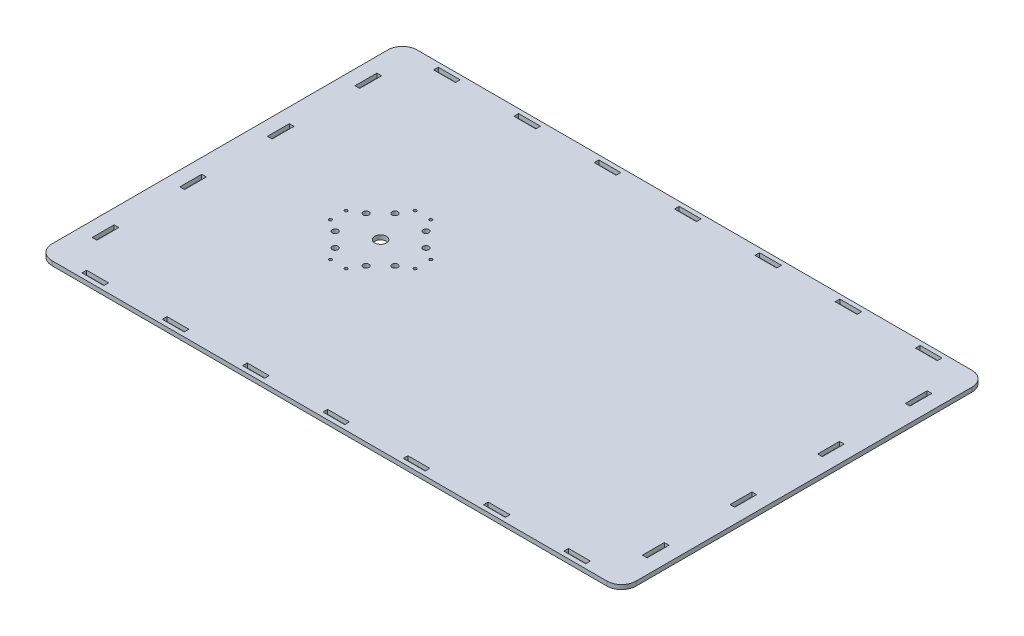
from build123d import *

# Parameters (mm, degrees)
SKETCH1_W           = 400
SKETCH1_H           = 250
SKETCH1_W_2         = 15
SKETCH1_H_2         = 3.2
SKETCH1_W_3         = 3.2
SKETCH1_H_3         = 15
BOSS_EXTRUDE2_DEPTH = 3
FILLET1_R           = 10
SKETCH2_R           = 2
SKETCH2_R_2         = 1
SKETCH2_R_3         = 4
CUT_EXTRUDE1_DEPTH  = 472.708596487


with BuildPart() as part:
    # Sketch1 → Boss-Extrude2 (new body)
    with BuildSketch(Plane(origin=(0, 0, 0), x_dir=(1, 0, 0), z_dir=(0, 1, 0))):
        with Locations((200, 125)):
            Rectangle(SKETCH1_W, SKETCH1_H)
        with Locations((90, 4.6)):
            Rectangle(SKETCH1_W_2, SKETCH1_H_2, mode=Mode.SUBTRACT)
        with Locations((35, 4.6)):
            Rectangle(SKETCH1_W_2, SKETCH1_H_2, mode=Mode.SUBTRACT)
        with Locations((145, 4.6)):
            Rectangle(SKETCH1_W_2, SKETCH1_H_2, mode=Mode.SUBTRACT)
        with Locations((200, 4.6)):
            Rectangle(SKETCH1_W_2, SKETCH1_H_2, mode=Mode.SUBTRACT)
        with Locations((255, 4.6)):
            Rectangle(SKETCH1_W_2, SKETCH1_H_2, mode=Mode.SUBTRACT)
        with Locations((310, 4.6)):
            Rectangle(SKETCH1_W_2, SKETCH1_H_2, mode=Mode.SUBTRACT)
        with Locations((365, 4.6)):
            Rectangle(SKETCH1_W_2, SKETCH1_H_2, mode=Mode.SUBTRACT)
        with Locations((365, 245.4)):
            Rectangle(SKETCH1_W_2, SKETCH1_H_2, mode=Mode.SUBTRACT)
        with Locations((310, 245.4)):
            Rectangle(SKETCH1_W_2, SKETCH1_H_2, mode=Mode.SUBTRACT)
        with Locations((255, 245.4)):
            Rectangle(SKETCH1_W_2, SKETCH1_H_2, mode=Mode.SUBTRACT)
        with Locations((200, 245.4)):
            Rectangle(SKETCH1_W_2, SKETCH1_H_2, mode=Mode.SUBTRACT)
        with Locations((35, 245.4)):
            Rectangle(SKETCH1_W_2, SKETCH1_H_2, mode=Mode.SUBTRACT)
        with Locations((90, 245.4)):
            Rectangle(SKETCH1_W_2, SKETCH1_H_2, mode=Mode.SUBTRACT)
        with Locations((145, 245.4)):
            Rectangle(SKETCH1_W_2, SKETCH1_H_2, mode=Mode.SUBTRACT)
        with Locations((11.6, 95)):
            Rectangle(SKETCH1_W_3, SKETCH1_H_3, mode=Mode.SUBTRACT)
        with Locations((11.6, 35)):
            Rectangle(SKETCH1_W_3, SKETCH1_H_3, mode=Mode.SUBTRACT)
        with Locations((11.6, 155)):
            Rectangle(SKETCH1_W_3, SKETCH1_H_3, mode=Mode.SUBTRACT)
        with Locations((11.6, 215)):
            Rectangle(SKETCH1_W_3, SKETCH1_H_3, mode=Mode.SUBTRACT)
        with Locations((388.4, 35)):
            Rectangle(SKETCH1_W_3, SKETCH1_H_3, mode=Mode.SUBTRACT)
        with Locations((388.4, 95)):
            Rectangle(SKETCH1_W_3, SKETCH1_H_3, mode=Mode.SUBTRACT)
        with Locations((388.4, 155)):
            Rectangle(SKETCH1_W_3, SKETCH1_H_3, mode=Mode.SUBTRACT)
        with Locations((388.4, 215)):
            Rectangle(SKETCH1_W_3, SKETCH1_H_3, mode=Mode.SUBTRACT)
    extrude(amount=BOSS_EXTRUDE2_DEPTH)

    # Fillet1
    fillet1_edges = [part.edges().sort_by_distance(p)[0] for p in [
        (0, 1.5, -250),
        (400, 1.5, -250),
        (400, 1.5, 0),
        (0, 1.5, 0),
    ]]
    fillet(fillet1_edges, radius=FILLET1_R)

    # Sketch2 → Cut-Extrude1 (cut, through all)
    with BuildSketch(Plane(origin=(0, 3, 0), x_dir=(1, 0, 0), z_dir=(0, 1, 0))):
        with Locations(Location((89.493903346, 135.606601718, 0), (0, 0, 270))):
            Circle(SKETCH2_R)
        with Locations(Location((120.606601718, 145.506096654, 0), (0, 0, 270))):
            Circle(SKETCH2_R)
        with Locations(Location((130.506096654, 135.606601718, 0), (0, 0, 270))):
            Circle(SKETCH2_R)
        with Locations(Location((99.393398282, 104.493903346, 0), (0, 0, 270))):
            Circle(SKETCH2_R)
        with Locations(Location((120.606601718, 104.493903346, 0), (0, 0, 270))):
            Circle(SKETCH2_R)
        with Locations(Location((89.493903346, 114.393398282, 0), (0, 0, 270))):
            Circle(SKETCH2_R)
        with Locations(Location((81, 119.62, 0), (0, 0, 270))):
            Circle(SKETCH2_R_2)
        with Locations(Location((110, 125, 0), (0, 0, 270))):
            Circle(SKETCH2_R_3)
        with Locations(Location((81, 130.38, 0), (0, 0, 270))):
            Circle(SKETCH2_R_2)
        with Locations(Location((99.393398282, 145.506096654, 0), (0, 0, 270))):
            Circle(SKETCH2_R)
        with Locations(Location((104.62, 154, 0), (0, 0, 270))):
            Circle(SKETCH2_R_2)
        with Locations(Location((115.38, 154, 0), (0, 0, 270))):
            Circle(SKETCH2_R_2)
        with Locations(Location((139, 130.38, 0), (0, 0, 270))):
            Circle(SKETCH2_R_2)
        with Locations(Location((139, 119.62, 0), (0, 0, 270))):
            Circle(SKETCH2_R_2)
        with Locations(Location((130.506096654, 114.393398282, 0), (0, 0, 270))):
            Circle(SKETCH2_R)
        with Locations(Location((115.38, 96, 0), (0, 0, 270))):
            Circle(SKETCH2_R_2)
        with Locations(Location((104.62, 96, 0), (0, 0, 270))):
            Circle(SKETCH2_R_2)
    extrude(amount=-CUT_EXTRUDE1_DEPTH, mode=Mode.SUBTRACT)


solid = part.part
